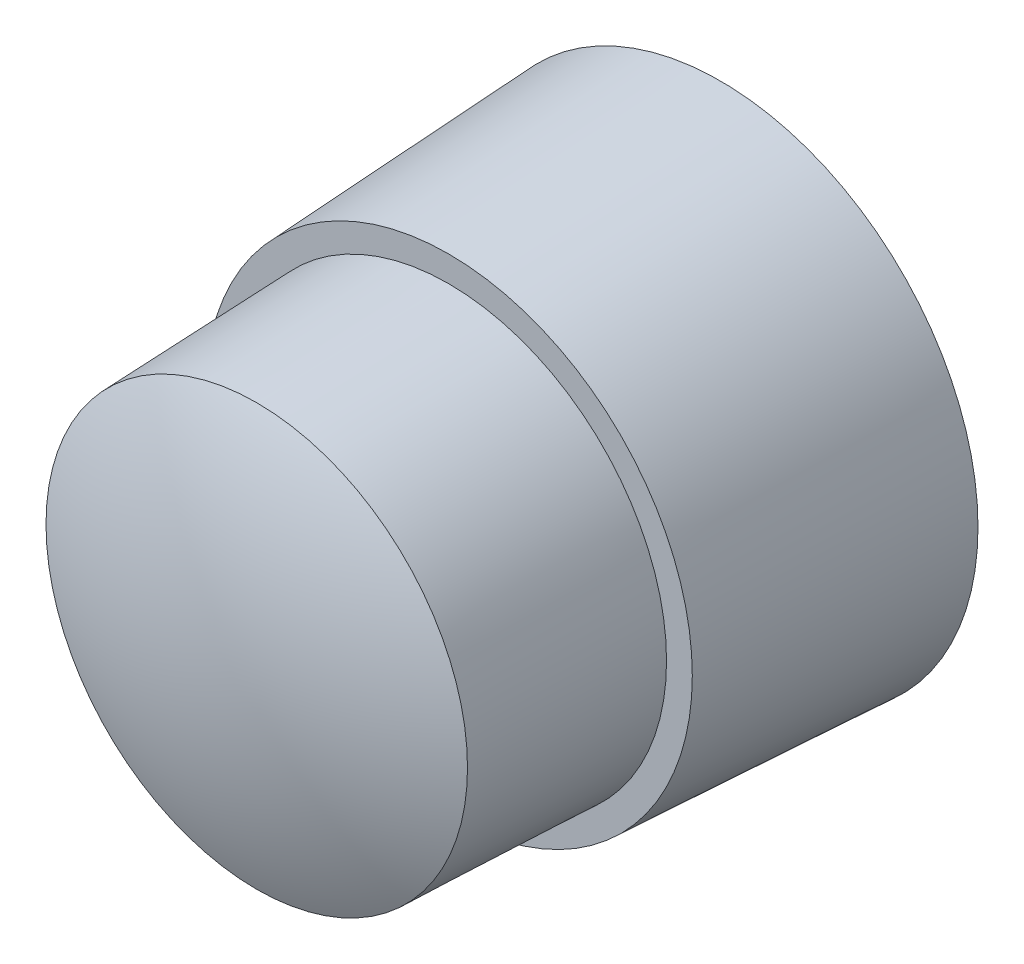
from build123d import *

# Parameters (mm, degrees)
SKETCH7_R           = 0.225
BOSS_EXTRUDE1_DEPTH = 2


with BuildPart() as part:
    # Sketch3 → Revolve1 (revolve)
    with BuildSketch(Plane(origin=(0, 0, 0), x_dir=(0, 0, -1), z_dir=(1, 0, 0)), mode=Mode.PRIVATE) as revolve1_sk:
        Polygon((0, 0), (0, 5.5), (-5.8, 5.2), (-5.8, 0), align=None)
    revolve(revolve1_sk.sketch.rotate(Axis((0, 0, 5.8), (0, 0, -1)), 90), axis=Axis((0, 0, 5.8), (0, 0, -1)))

    # Sketch5 → Revolve2 (revolve)
    with BuildSketch(Plane(origin=(0, 0, 0), x_dir=(0, 0, -1), z_dir=(1, 0, 0)), mode=Mode.PRIVATE) as revolve2_sk:
        Polygon((-5.8, 4.65), (-9.9, 4.5), (-9.9, 0), (-5.8, 0), align=None)
    revolve(revolve2_sk.sketch.rotate(Axis((0, 0, 9.9), (0, 0, -1)), 180), axis=Axis((0, 0, 9.9), (0, 0, -1)))

    # Sketch6 → Revolve3 (revolve)
    with BuildSketch(Plane(origin=(0, 0, 0), x_dir=(0, 0, -1), z_dir=(1, 0, 0))):
        with BuildLine():
            Line((-10.9, 0), (-9.9, 0))
            Line((-9.9, 0), (-9.9, 4.5))
            ThreePointArc((-9.9, 4.5), (-10.646987514, 2.304886114), (-10.9, 0))
        make_face()
    revolve(axis=Axis((0, 0, 0), (0, 0, 1)))

    # Sketch7 → Boss-Extrude1 (add)
    with BuildSketch(Plane(origin=(0, 0, 0), x_dir=(-1, 0, 0), z_dir=(0, 0, -1))):
        with Locations(Location((2.54, 0.048471669, 0), (0, 0, 180))):
            Circle(SKETCH7_R)
        with Locations(Location((0, -2.491528331, 0), (0, 0, 180))):
            Circle(SKETCH7_R)
        with Locations(Location((-2.54, 0.048471669, 0), (0, 0, 180))):
            Circle(SKETCH7_R)
    extrude(amount=BOSS_EXTRUDE1_DEPTH)


solid = part.part
